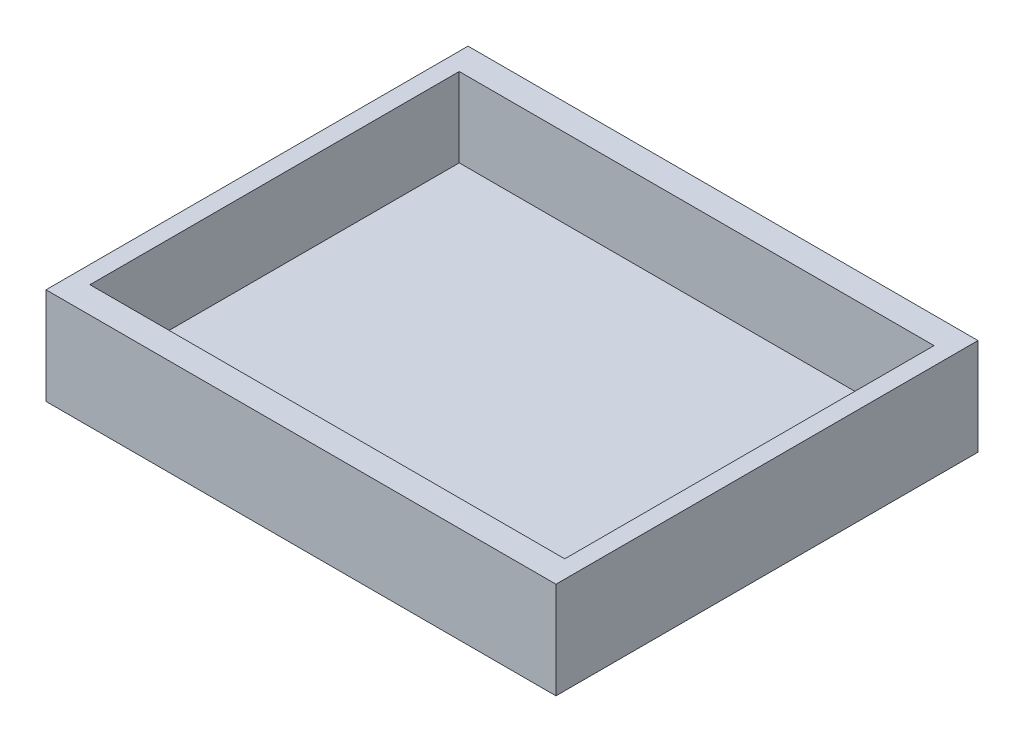
from build123d import *

# Parameters (mm, degrees)
SKETCH1_W         = 68.58
SKETCH1_H         = 53.34
PCB_BASE_DEPTH    = 2.54
SKETCH1_4_W       = 73.66
SKETCH1_4_H       = 60.96
SKETCH1_4_W_2     = 68.58
SKETCH1_4_H_2     = 53.34
PCB_WALL_DEPTH    = 13.97
SKETCH3_R         = 1.651
BATTERY_GAP_DEPTH = 2.54


with BuildPart() as part:
    # Sketch1 → pcb-base (new body)
    with BuildSketch(Plane(origin=(0, 0, 0), x_dir=(1, 0, 0), z_dir=(0, 1, 0))):
        Rectangle(SKETCH1_W, SKETCH1_H)
    extrude(amount=PCB_BASE_DEPTH)

    # Sketch1<4> → pcb-wall (add)
    with BuildSketch(Plane(origin=(0, 0, 0), x_dir=(1, 0, 0), z_dir=(0, 1, 0))):
        Rectangle(SKETCH1_4_W, SKETCH1_4_H)
        Rectangle(SKETCH1_4_W_2, SKETCH1_4_H_2, mode=Mode.SUBTRACT)
    extrude(amount=PCB_WALL_DEPTH)

    # Sketch3 → battery-gap (cut)
    with BuildSketch(Plane.ZY.offset(36.83)):
        with Locations((20.32, 4.318)):
            Circle(SKETCH3_R)
    extrude(amount=-BATTERY_GAP_DEPTH, mode=Mode.SUBTRACT)


solid = part.part
